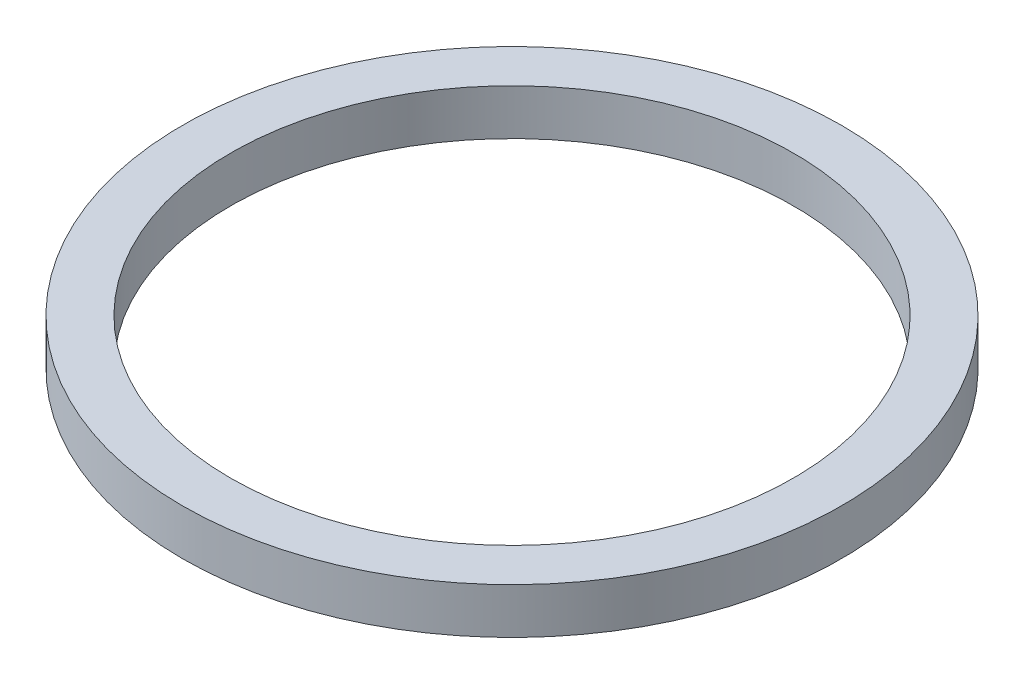
from build123d import *

# Parameters (mm, degrees)
SKETCH1_R           = 3.6
SKETCH1_R_2         = 3.075
BOSS_EXTRUDE1_DEPTH = 0.5


with BuildPart() as part:
    # Sketch1 → Boss-Extrude1 (new body)
    with BuildSketch(Plane(origin=(0, 0, 0), x_dir=(1, 0, 0), z_dir=(0, 1, 0))):
        with Locations(Location((0, 0, 0), (0, 0, 270))):
            Circle(SKETCH1_R)
        with Locations(Location((0, 0, 0), (0, 0, 270))):
            Circle(SKETCH1_R_2, mode=Mode.SUBTRACT)
    extrude(amount=BOSS_EXTRUDE1_DEPTH)


solid = part.part
